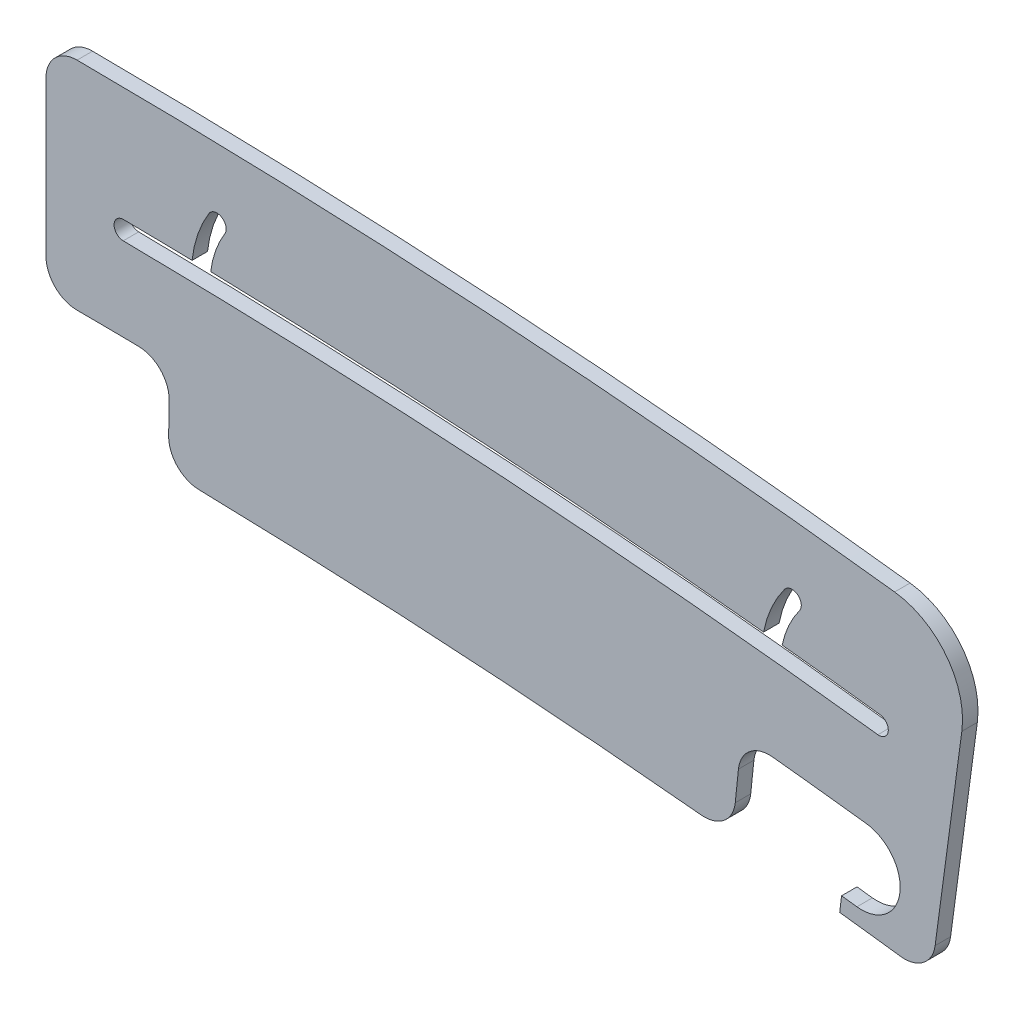
from build123d import *
from OCP.BRepFilletAPI import BRepFilletAPI_MakeFillet

# Parameters (mm, degrees)
P_IDAT_VYSUNUT_M1_DEPTH       = 1
ODEBRAT_VYSUNUT_M1_DEPTH      = 65.439881064
ODEBRAT_VYSUNUT_M3_DEPTH      = 65.439881064
ODEBRAT_VYSUNUT_M3_DEPTH_BACK = 65.439881064
ODEBRAT_VYSUNUT_M4_DEPTH      = 65.439881064
ODEBRAT_VYSUNUT_M4_DEPTH_BACK = 65.439881064
ZAOBLIT1_R1                   = 2
ZAOBLIT1_R2                   = 5
ODEBRAT_VYSUNUT_M5_DEPTH      = 64.769631591
ODEBRAT_VYSUNUT_M8_DEPTH      = 64.769631591


with BuildPart() as part:
    # Skica1 → Přidat vysunutím1 (new body)
    with BuildSketch(Plane.XY):
        with BuildLine():
            Line((0, 0), (0, -20))
            ThreePointArc((0, -20), (28.666666667, -20.95661965), (57.205784047, -23.822222222))
            Line((57.205784047, -23.822222222), (59.866518188, -4))
            ThreePointArc((59.866518188, -4), (30, -1.001113587), (0, 0))
        make_face()
    extrude(amount=P_IDAT_VYSUNUT_M1_DEPTH)

    # Skica2 → Odebrat vysunutím1 (cut, through all)
    with BuildSketch(Plane.XY.offset(1)):
        with BuildLine():
            ThreePointArc((5.00678733, -7.428319839), (4.400038391, -8.021494117), (4.99321267, -8.628243057))
            ThreePointArc((4.99321267, -8.628243057), (29.426706516, -9.581983857), (53.769895868, -11.887276722))
            ThreePointArc((53.769895868, -11.887276722), (54.438517462, -11.36483518), (53.916075921, -10.696213586))
            ThreePointArc((53.916075921, -10.696213586), (29.506706624, -8.3846535), (5.00678733, -7.428319839))
        make_face()
    extrude(amount=-ODEBRAT_VYSUNUT_M1_DEPTH, mode=Mode.SUBTRACT)

    # Skica4 → Odebrat vysunutím3 (cut, two sides: drawn at the far end of the back side and taken through both)
    with BuildSketch(Plane.XY.offset(1).offset(-ODEBRAT_VYSUNUT_M3_DEPTH_BACK)):
        with BuildLine():
            Line((-132.963409192, -14), (0, -14))
            ThreePointArc((0, -14), (4.000168361, -14.018350555), (8, -14.073400674))
            Line((8, -14.073400674), (7.889908257, -20.072390573))
            Line((7.889908257, -20.072390573), (5.450212675, -153.013415352))
            Line((5.450212675, -153.013415352), (-182.994540511, -340.645096397))
            Line((-182.994540511, -340.645096397), (-321.408162378, -201.631681045))
            Line((-321.408162378, -201.631681045), (-132.963409192, -14))
        make_face()
    extrude(amount=ODEBRAT_VYSUNUT_M3_DEPTH + ODEBRAT_VYSUNUT_M3_DEPTH_BACK, mode=Mode.SUBTRACT)

    # Skica5 → Odebrat vysunutím4 (cut, two sides: drawn at the far end of the back side and taken through both)
    with BuildSketch(Plane.XY.offset(1).offset(-ODEBRAT_VYSUNUT_M4_DEPTH_BACK)):
        with BuildLine():
            Line((36.686520611, -144.697920219), (51.301744348, -23.071281094))
            Line((51.301744348, -23.071281094), (51.42105073, -22.078423608))
            Line((51.42105073, -22.078423608), (52.413908216, -22.19772999))
            ThreePointArc((52.413908216, -22.19772999), (55.198271053, -19.978877549), (52.940438573, -17.226029013))
            ThreePointArc((52.940438573, -17.226029013), (48.954265765, -16.757019834), (44.963944364, -16.324725506))
            Line((44.963944364, -16.324725506), (44.345174487, -22.292733871))
            Line((44.345174487, -22.292733871), (31.711790282, -144.141171338))
            Line((31.711790282, -144.141171338), (4.462279657, -387.624313691))
            Line((4.462279657, -387.624313691), (9.437009987, -388.181062571))
            Line((9.437009987, -388.181062571), (36.686520611, -144.697920219))
        make_face()
    extrude(amount=ODEBRAT_VYSUNUT_M4_DEPTH + ODEBRAT_VYSUNUT_M4_DEPTH_BACK, mode=Mode.SUBTRACT)

    # Zaoblit1: one fillet with a radius per group of edges: ONE call of the kernel's fillet builder (fillet() takes one radius for all edges)
    zaoblit1_edges_1 = [part.edges().sort_by_distance(p)[0] for p in [
        (0, 0, 0.5),
        (57.205784047, -23.822222222, 0.5),
        (44.345174487, -22.292733871, 0.5),
        (0, -14, 0.5),
        (7.889908257, -20.072390573, 0.5),
        (8, -14.073400674, 0.5),
        (44.963944364, -16.324725506, 0.5),
    ]]
    zaoblit1_edges_2 = [part.edges().sort_by_distance(p)[0] for p in [
        (59.866518188, -4, 0.5),
    ]]
    zaoblit1 = BRepFilletAPI_MakeFillet(part.part.solid().wrapped)
    for e in zaoblit1_edges_1:
        zaoblit1.Add(ZAOBLIT1_R1, e.wrapped)
    for e in zaoblit1_edges_2:
        zaoblit1.Add(ZAOBLIT1_R2, e.wrapped)
    add(Compound.cast(zaoblit1.Shape()), mode=Mode.REPLACE)

    # Skica6 → Odebrat vysunutím5 (cut, through all)
    with BuildSketch(Plane.XY.offset(1)):
        with BuildLine():
            ThreePointArc((47.737088512, -6.766480836), (46.77391733, -8.500998009), (46.292491489, -10.425699987))
            ThreePointArc((46.292491489, -10.425699987), (46.820211166, -11.090163638), (47.484674816, -10.562443961))
            ThreePointArc((47.484674816, -10.562443961), (47.890086051, -8.941642295), (48.701177572, -7.480996255))
            ThreePointArc((48.701177572, -7.480996255), (48.576390751, -6.641694015), (47.737088512, -6.766480836))
        make_face()
    extrude(amount=-ODEBRAT_VYSUNUT_M5_DEPTH, mode=Mode.SUBTRACT)

    # Skica7 → Odebrat vysunutím8 (cut, through all)
    with BuildSketch(Plane.XY):
        with BuildLine():
            ThreePointArc((10.533609812, -4.327670598), (9.718743083, -6.136604196), (9.399828731, -8.094802905))
            ThreePointArc((9.399828731, -8.094802905), (9.981225335, -8.712846584), (10.599269014, -8.13144998))
            ThreePointArc((10.599269014, -8.13144998), (10.867828468, -6.482440541), (11.55403203, -4.959128038))
            ThreePointArc((11.55403203, -4.959128038), (11.359549641, -4.133188209), (10.533609812, -4.327670598))
        make_face()
    extrude(amount=ODEBRAT_VYSUNUT_M8_DEPTH, mode=Mode.SUBTRACT)


solid = part.part
